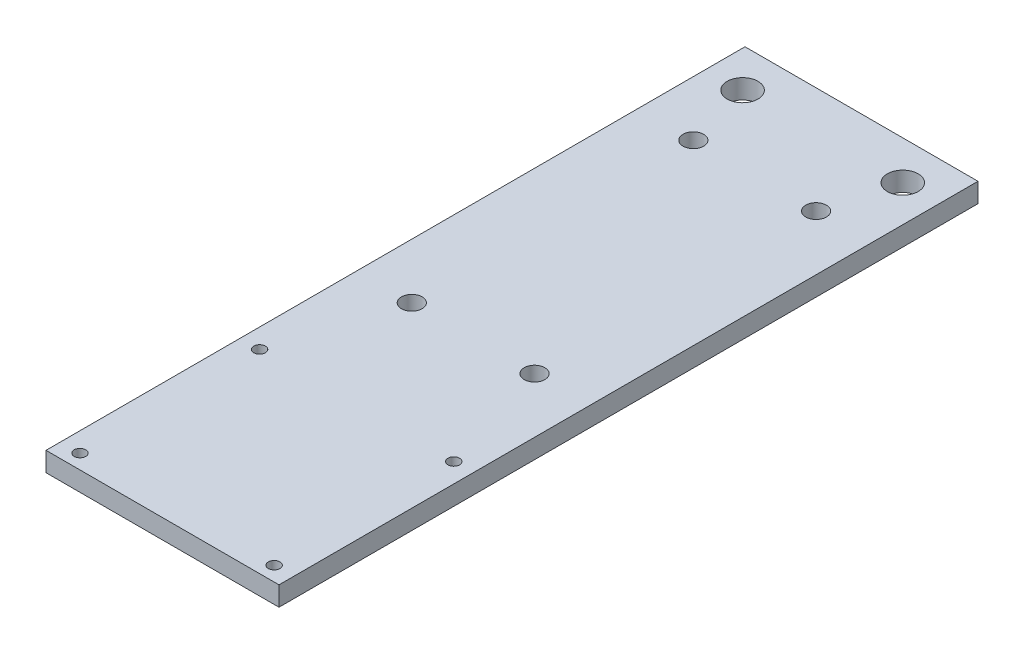
from build123d import *

# Parameters (mm, degrees)
PLATE_SKETCH_W          = 76.2
PLATE_SKETCH_H          = 228.6
PLATE_EXTRUDE_DEPTH     = 6.35
F_1_4_CLEARANCE_HOLE2_D = 6.7564
F_6_CLEARANCE_HOLE1_D   = 3.7973
F_3_8_CLEARANCE_HOLE1_D = 10.0838


with BuildPart() as part:
    # Plate sketch → Plate extrude (new body)
    with BuildSketch(Plane(origin=(0, 0, 0), x_dir=(1, 0, 0), z_dir=(0, 1, 0))):
        Rectangle(PLATE_SKETCH_W, PLATE_SKETCH_H)
    extrude(amount=PLATE_EXTRUDE_DEPTH)

    # 1/4 Clearance Hole2 (through all)
    with Locations(Plane(origin=(0, 6.35, 0), x_dir=(1, 0, 0), z_dir=(0, 1, 0))):
        with Locations((-20.066, 79.375), (20.066, -12.7), (-20.066, -12.7), (20.066, 79.375)):
            Hole(F_1_4_CLEARANCE_HOLE2_D / 2)

    # #6 Clearance Hole1 (through all)
    with Locations(Plane(origin=(0, 6.35, 0), x_dir=(1, 0, 0), z_dir=(0, 1, 0))):
        with Locations((-31.75, -50.8), (-31.75, -109.5375), (31.75, -50.8), (31.75, -109.5375)):
            Hole(F_6_CLEARANCE_HOLE1_D / 2)

    # 3/8 Clearance Hole1 (through all)
    with Locations(Plane(origin=(0, 6.35, 0), x_dir=(1, 0, 0), z_dir=(0, 1, 0))):
        with Locations((-26.19375, 101.6), (26.19375, 101.6)):
            Hole(F_3_8_CLEARANCE_HOLE1_D / 2)


solid = part.part
